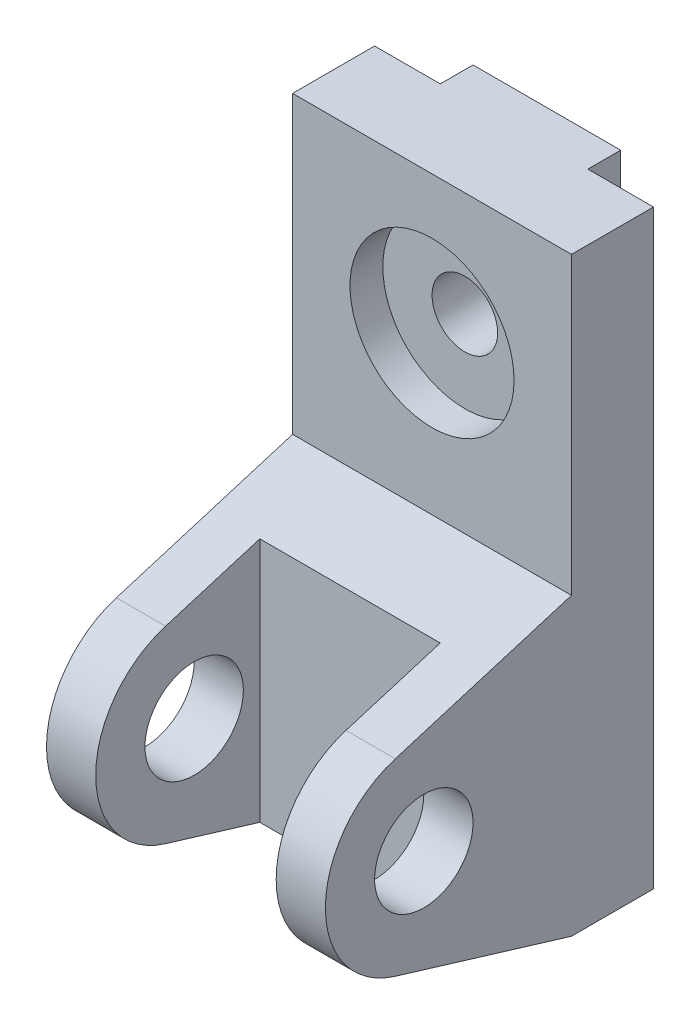
from build123d import *

# Parameters (mm, degrees)
SKETCH1_R                                            = 15
BOSS_EXTRUDE1_DEPTH                                  = 85
SKETCH2_W                                            = 55
SKETCH2_H                                            = 61.612592623
CUT_EXTRUDE1_DEPTH                                   = 85
SKETCH3_W                                            = 45
SKETCH3_H                                            = 10
BOSS_EXTRUDE2_DEPTH                                  = 180
CBORE_FOR_1_4_BINDING_HEAD_MACHINE_SCREW_D           = 19.999999878
CBORE_FOR_1_4_BINDING_HEAD_MACHINE_SCREW_CBORE_D     = 50.000000076
CBORE_FOR_1_4_BINDING_HEAD_MACHINE_SCREW_CBORE_DEPTH = 10.000000066


with BuildPart() as part:
    # Sketch1 → Boss-Extrude1 (new body)
    with BuildSketch(Plane(origin=(0, 0, 0), x_dir=(0, 0, -1), z_dir=(1, 0, 0))):
        with BuildLine():
            Line((0, 180), (0, 0))
            Line((0, 0), (-25, 0))
            Line((-25, 0), (-78.708286934, 16.291713066))
            ThreePointArc((-78.708286934, 16.291713066), (-100, 45), (-78.708286934, 73.708286934))
            Line((-78.708286934, 73.708286934), (-25, 90))
            Line((-25, 90), (-25, 180))
            Line((-25, 180), (0, 180))
        make_face()
        with Locations((-70, 45)):
            Circle(SKETCH1_R, mode=Mode.SUBTRACT)
    extrude(amount=-BOSS_EXTRUDE1_DEPTH)

    # Sketch2 → Cut-Extrude1 (cut)
    with BuildSketch(Plane.XZ):
        with Locations((-42.5, 80.806296312)):
            Rectangle(SKETCH2_W, SKETCH2_H)
    extrude(amount=-CUT_EXTRUDE1_DEPTH, mode=Mode.SUBTRACT)

    # Sketch3 → Boss-Extrude2 (add)
    with BuildSketch(Plane.XZ):
        with Locations((-42.5, -5)):
            Rectangle(SKETCH3_W, SKETCH3_H)
    extrude(amount=-BOSS_EXTRUDE2_DEPTH)

    # CBORE for 1/4 Binding Head Machine Screw1 (through all)
    with Locations(Plane.XY.offset(25)):
        with Locations((-42.5, 138)):
            CounterBoreHole(CBORE_FOR_1_4_BINDING_HEAD_MACHINE_SCREW_D / 2, CBORE_FOR_1_4_BINDING_HEAD_MACHINE_SCREW_CBORE_D / 2, CBORE_FOR_1_4_BINDING_HEAD_MACHINE_SCREW_CBORE_DEPTH)


solid = part.part
